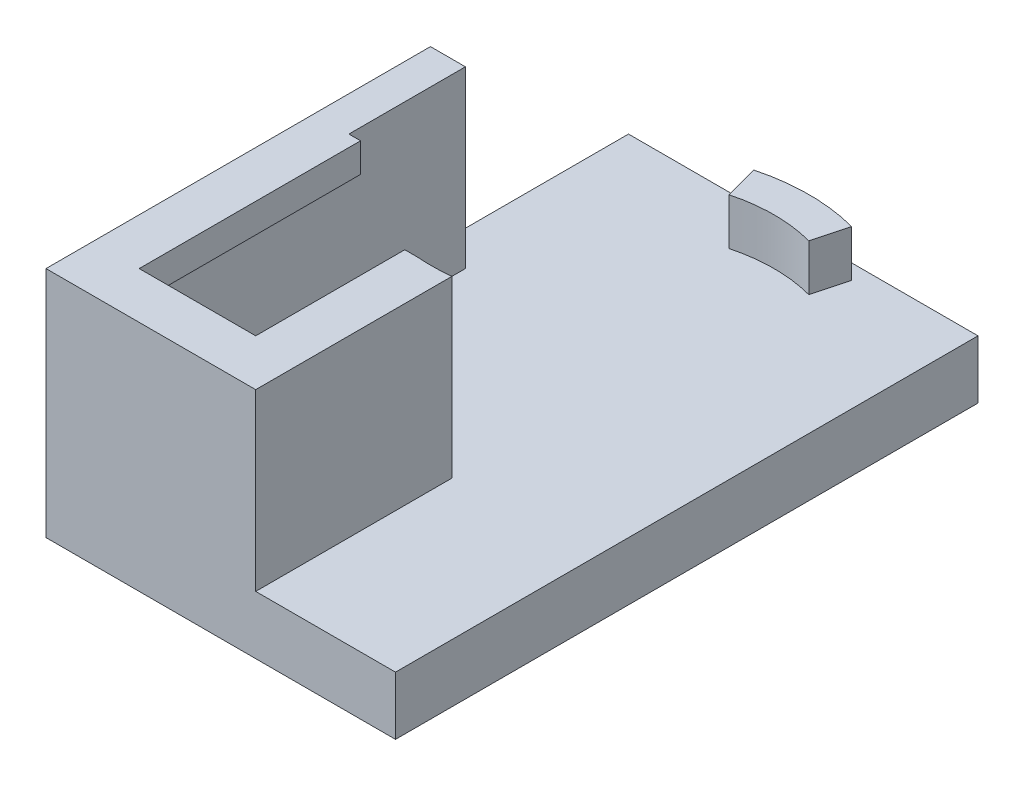
from build123d import *

# Parameters (mm, degrees)
SKETCH1_W               = 45
SKETCH1_H               = 85
BOSS_EXTRUDE1_DEPTH     = 100
SHELL1_T                = -5
SKETCH2_W               = 3
SKETCH2_H               = 10
BOSS_EXTRUDE2_DEPTH     = 15
SKETCH4_W               = 20
SKETCH4_H               = 2.5
BOSS_EXTRUDE3_DEPTH     = 1
SKETCH5_W               = 13.798148254
SKETCH5_H               = 2.5
BOSS_EXTRUDE4_DEPTH     = 1
SKETCH6_W               = 10
SKETCH6_H               = 2.5
BOSS_EXTRUDE5_DEPTH     = 1
SKETCH9_W               = 10.477527882
SKETCH9_H               = 6.322646136
CUT_EXTRUDE1_DEPTH      = 11
CUT_EXTRUDE2_DEPTH      = 107.477697195
CUT_EXTRUDE2_DEPTH_BACK = 107.477697195
SKETCH10_W              = 54.233150032
SKETCH10_H              = 93.874108495
SKETCH10_W_2            = 30
SKETCH10_H_2            = 50


with BuildPart() as part:
    # Sketch1 → Boss-Extrude1 (new body)
    with BuildSketch(Plane(origin=(0, 0, 0), x_dir=(1, 0, 0), z_dir=(0, 1, 0))):
        Rectangle(SKETCH1_W, SKETCH1_H)
    extrude(amount=BOSS_EXTRUDE1_DEPTH)

    # Shell1
    shell1_openings = [part.faces().sort_by_distance(p)[0] for p in [
        (0, 100, 0),
    ]]
    offset(amount=SHELL1_T, openings=shell1_openings, kind=Kind.INTERSECTION)

    # Sketch2 → Boss-Extrude2 (add)
    with BuildSketch(Plane(origin=(0, 5, 0), x_dir=(1, 0, 0), z_dir=(0, 1, 0))):
        with BuildLine():
            Line((-13.25, -30), (-13.25, -25))
            Line((-13.25, -25), (-16.25, -25))
            Line((-16.25, -25), (-16.25, -33))
            Line((-16.25, -33), (1.75, -33))
            Line((1.75, -33), (1.75, -16.155494421))
            ThreePointArc((1.75, -16.155494421), (0.251072202, -16.248060277), (-1.25, -16.201851746))
            Line((-1.25, -16.201851746), (-1.25, -30))
            Line((-1.25, -30), (-13.25, -30))
        make_face()
        with Locations((-14.75, -20)):
            Rectangle(SKETCH2_W, SKETCH2_H)
        with BuildLine():
            Line((-16.25, -15), (-13.25, -15))
            Line((-13.25, -15), (-13.25, -9.407443861))
            ThreePointArc((-13.25, -9.407443861), (-15.481844205, -4.937104415), (-16.25, 0))
            Line((-16.25, 0), (-16.25, -15))
        make_face()
        with BuildLine():
            Line((-4.205809483, 15.696294677), (-3.429352348, 12.798517198))
            ThreePointArc((-3.429352348, 12.798517198), (0, 13.25), (3.429352348, 12.798517198))
            Line((3.429352348, 12.798517198), (4.205809483, 15.696294677))
            ThreePointArc((4.205809483, 15.696294677), (0, 16.25), (-4.205809483, 15.696294677))
        make_face()
        with BuildLine():
            ThreePointArc((-16.25, 0), (-15.481844205, -4.937104415), (-13.25, -9.407443861))
            Line((-13.25, -9.407443861), (-13.25, 0))
            Line((-13.25, 0), (-16.25, 0))
        make_face()
    extrude(amount=BOSS_EXTRUDE2_DEPTH)

    # Sketch4 → Boss-Extrude3 (add)
    with BuildSketch(Plane(origin=(-13.25, 0, 0), x_dir=(0, 0, -1), z_dir=(1, 0, 0))):
        with Locations((-20, 18.75)):
            Rectangle(SKETCH4_W, SKETCH4_H)
    extrude(amount=BOSS_EXTRUDE3_DEPTH)

    # Sketch5 → Boss-Extrude4 (add)
    with BuildSketch(Plane.ZY.offset(1.25)):
        with Locations((23.100925873, 18.75)):
            Rectangle(SKETCH5_W, SKETCH5_H)
    extrude(amount=BOSS_EXTRUDE4_DEPTH)

    # Sketch6 → Boss-Extrude5 (add)
    with BuildSketch(Plane(origin=(0, 0, 30), x_dir=(-1, 0, 0), z_dir=(0, 0, -1))):
        with Locations((7.25, 18.75)):
            Rectangle(SKETCH6_W, SKETCH6_H)
    extrude(amount=BOSS_EXTRUDE5_DEPTH)

    # Sketch9 → Cut-Extrude1 (cut)
    with BuildSketch(Plane(origin=(0, 20, 0), x_dir=(1, 0, 0), z_dir=(0, 1, 0))):
        with Locations((0.163497959, 14.216347227)):
            Rectangle(SKETCH9_W, SKETCH9_H)
    extrude(amount=-CUT_EXTRUDE1_DEPTH, mode=Mode.SUBTRACT)

    # Sketch10 → Cut-Extrude2 (cut, two sides: drawn at the far end of the back side and taken through both)
    with BuildSketch(Plane(origin=(0, 5, 0), x_dir=(1, 0, 0), z_dir=(0, 1, 0)).offset(-CUT_EXTRUDE2_DEPTH_BACK)):
        with Locations((1.369563357, 1.0979216)):
            Rectangle(SKETCH10_W, SKETCH10_H)
        with Locations((-1.25, -8)):
            Rectangle(SKETCH10_W_2, SKETCH10_H_2, mode=Mode.SUBTRACT)
    extrude(amount=CUT_EXTRUDE2_DEPTH + CUT_EXTRUDE2_DEPTH_BACK, mode=Mode.SUBTRACT)


solid = part.part
